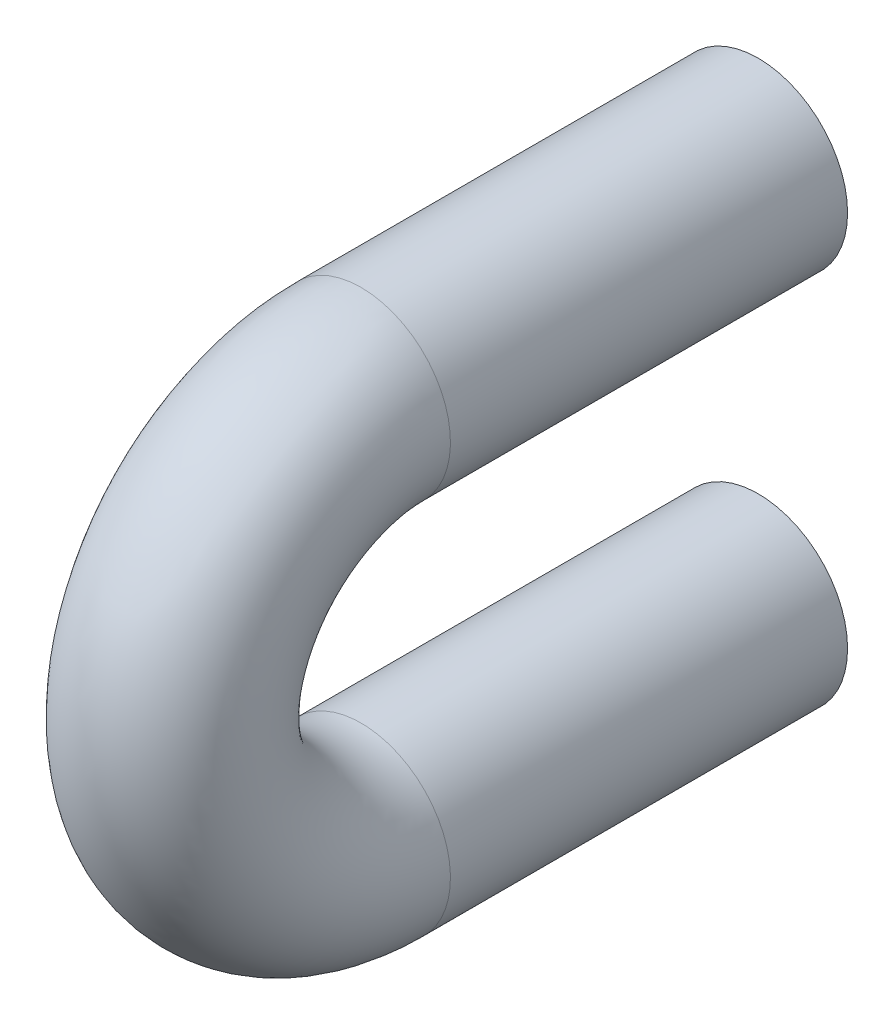
from build123d import *

# Parameters (mm, degrees)
ESQUISSE2_R             = 4.5
ESQUISSE4_R             = 3
ENL_V_MAT_EXTRU_1_DEPTH = 18


with BuildPart() as part:
    # Base-Balayage: sweep along a path in Esquisse3
    with BuildLine(Plane(origin=(0, 0, 0), x_dir=(0, 0, -1), z_dir=(1, 0, 0))) as base_balayage_path:
        Line((0, 0), (-20, 0))
        ThreePointArc((-20, 0), (-29.5, 9.5), (-20, 19))
        Line((-20, 19), (0, 19))
    # Esquisse2 → Base-Balayage (sweep)
    with BuildSketch(Plane.XY):
        Circle(ESQUISSE2_R)
    sweep(path=base_balayage_path.line)

    # Esquisse4 → Enlèv. mat.-Extru.1 (cut)
    with BuildSketch(Plane(origin=(0, 0, 0), x_dir=(-1, 0, 0), z_dir=(0, 0, -1))):
        with Locations(Location((0, 19, 0), (0, 0, 90))):
            Circle(ESQUISSE4_R)
        with Locations(Location((0, 0, 0), (0, 0, 90))):
            Circle(ESQUISSE4_R)
    extrude(amount=-ENL_V_MAT_EXTRU_1_DEPTH, mode=Mode.SUBTRACT)


solid = part.part
